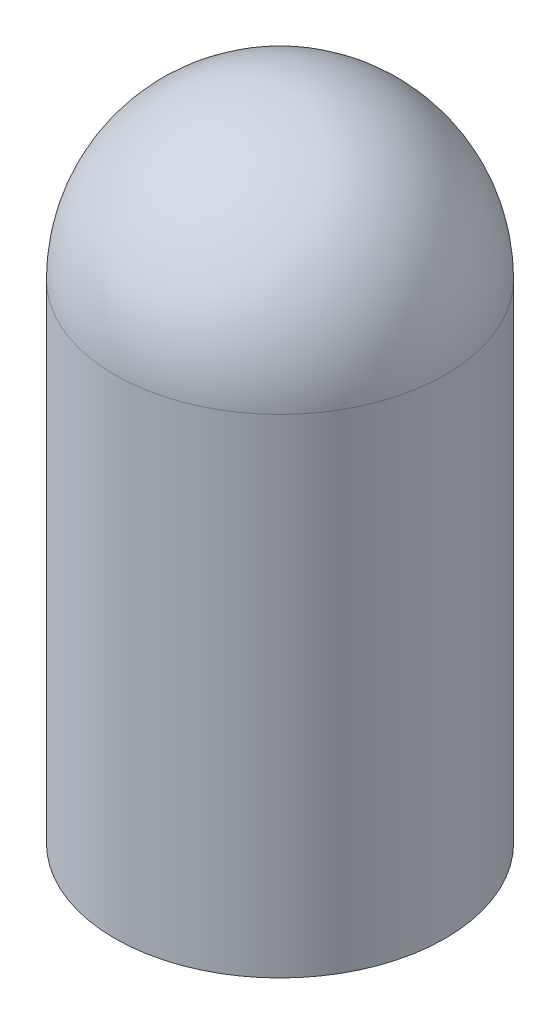
from build123d import *

# Parameters (mm, degrees)
SHELL3_T = 5.08


with BuildPart() as part:
    # Sketch2 → Revolve1 (revolve)
    with BuildSketch(Plane.XY):
        with BuildLine():
            Line((-50.8, 111.397142857), (-50.8, 162.197142857))
            ThreePointArc((-50.8, 162.197142857), (-86.721024484, 147.318167341), (-101.6, 111.397142857))
            Line((-101.6, 111.397142857), (-101.6, -53.702857143))
            Line((-101.6, -53.702857143), (-50.8, -53.702857143))
            Line((-50.8, -53.702857143), (-50.8, 111.397142857))
        make_face()
    revolve(axis=Axis((-50.8, 162.197142857, 0), (0, -1, 0)))

    # Shell3
    shell3_openings = [part.faces().sort_by_distance(p)[0] for p in [
        (-50.8, -53.702857143, 0),
    ]]
    offset(amount=SHELL3_T, openings=shell3_openings, kind=Kind.INTERSECTION)


solid = part.part
